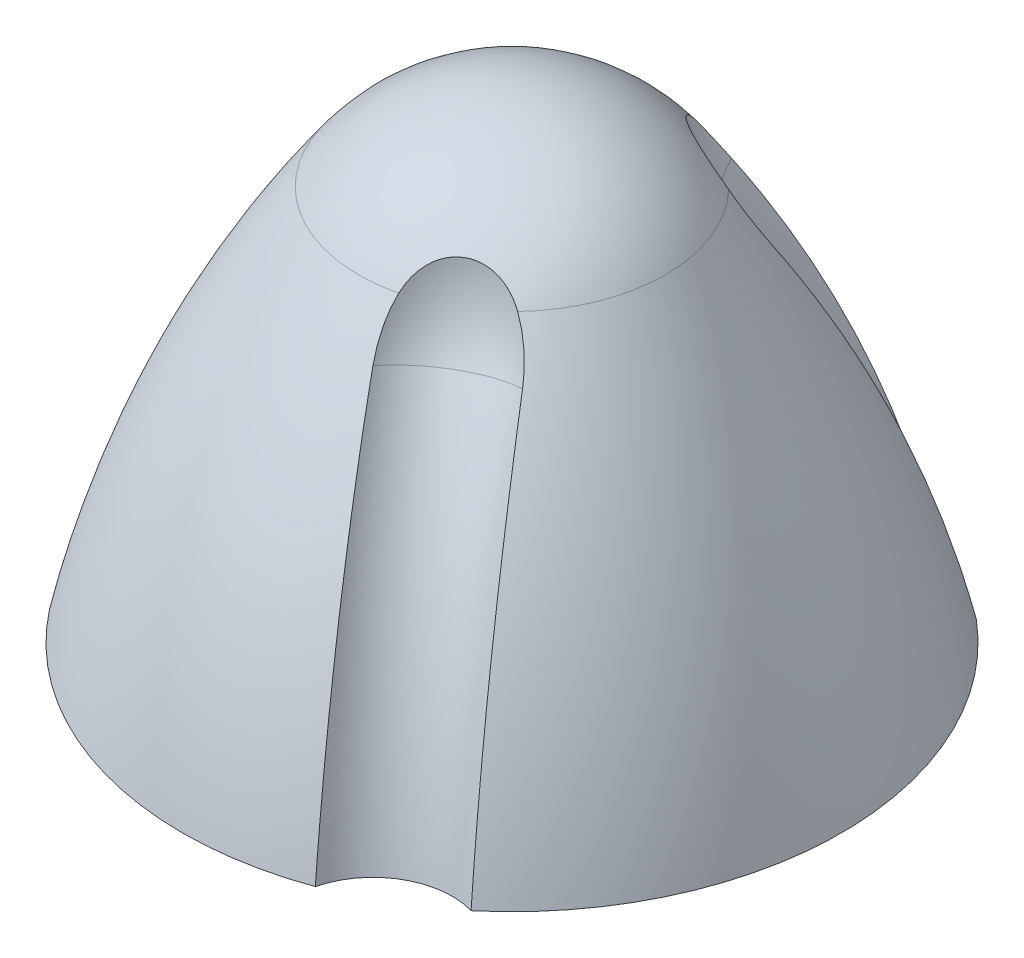
from build123d import *

# Parameters (mm, degrees)
CUT_EXTRUDE1_REACH             = 47.963
SKETCH2_W                      = 34.925
SKETCH2_H                      = 22.225
CUT_EXTRUDE1_DIRECTION_2_REACH = 47.963
CUT_EXTRUDE2_DEPTH             = 9.525
CIRPATTERN1_COUNT              = 3
SKETCH6_R                      = 6.35
CUT_EXTRUDE3_DEPTH             = 3.175


with BuildPart() as part:
    # Sketch1 → Revolve1 (revolve)
    with BuildSketch(Plane.XY):
        with BuildLine():
            Line((0, 41.275), (0, 0))
            Line((0, 0), (7.5, 0))
            ThreePointArc((7.5, 0), (12.485619708, 5.484310547), (14.299969698, 12.670561319))
            ThreePointArc((14.299969698, 12.670561319), (14.3, 12.7), (14.299969698, 12.729438681))
            ThreePointArc((14.299969698, 12.729438681), (12.201631467, 26.047427638), (6.1595, 38.1))
            ThreePointArc((6.1595, 38.1), (3.464825582, 40.434546629), (0, 41.275))
        make_face()
    revolve(axis=Axis((0, 0, 0), (0, 1, 0)))

    # Sketch2 → Cut-Extrude1 (cut, up to next)
    with BuildSketch(Plane(origin=(0, 0, 0), x_dir=(0, 0, -1), z_dir=(1, 0, 0)), mode=Mode.PRIVATE) as cut_extrude1_sk1:
        with Locations((0, 11.1125)):
            Rectangle(SKETCH2_W, SKETCH2_H)
    cut_extrude1_tool1 = extrude(cut_extrude1_sk1.sketch, amount=-CUT_EXTRUDE1_REACH, mode=Mode.PRIVATE) & part.part
    add(cut_extrude1_tool1.solids().sort_by_distance((0, 11.1125, 0))[0], mode=Mode.SUBTRACT)

    # Sketch2 → Cut-Extrude1 direction 2 (cut, up to next)
    with BuildSketch(Plane(origin=(0, 0, 0), x_dir=(0, 0, -1), z_dir=(1, 0, 0)), mode=Mode.PRIVATE) as cut_extrude1_direction_2_sk1:
        with Locations((0, 11.1125)):
            Rectangle(SKETCH2_W, SKETCH2_H)
    cut_extrude1_direction_2_tool1 = extrude(cut_extrude1_direction_2_sk1.sketch, amount=CUT_EXTRUDE1_DIRECTION_2_REACH, mode=Mode.PRIVATE) & part.part
    add(cut_extrude1_direction_2_tool1.solids().sort_by_distance((0, 11.1125, 0))[0], mode=Mode.SUBTRACT)

    # Sketch3 → Cut-Extrude2 (cut)
    with BuildSketch(Plane.XZ.offset(-22.225)):
        with BuildLine():
            Line((-2.434829201, -1.7526), (2.434829201, -1.7526))
            ThreePointArc((2.434829201, -1.7526), (0, 3), (-2.434829201, -1.7526))
        make_face()
    extrude(amount=-CUT_EXTRUDE2_DEPTH, mode=Mode.SUBTRACT)

    # Cut-Sweep1: sweep along a path in Sketch4
    with BuildLine(Plane.XY) as cut_sweep1_path:
        Line((-6.35, 41.275), (-6.35, 39.7002))
        ThreePointArc((-6.35, 39.7002), (-6.599150778, 37.96819754), (-7.326398315, 36.376651231))
        ThreePointArc((-7.326398315, 36.376651231), (-10.906399133, 29.561182531), (-13.240375425, 22.225))
    # Sketch5 → Cut-Sweep1 (sweep, cut)
    with BuildSketch(Plane.XZ.offset(-22.225)):
        with BuildLine():
            ThreePointArc((-13.04083059, 2.290039063), (-12.065, 0), (-13.04083059, -2.290039063))
            ThreePointArc((-13.04083059, -2.290039063), (-13.240375425, 0), (-13.04083059, 2.290039063))
        make_face()
    cut_sweep1 = sweep(path=cut_sweep1_path.line, mode=Mode.SUBTRACT)

    # CirPattern1: Cut-Sweep1 ×3 about axis
    cirpattern1_axis = Axis((0, 42.243264125, 0), (0, -1, 0))
    for i in range(1, CIRPATTERN1_COUNT):
        add(cut_sweep1.rotate(cirpattern1_axis, i * 360 / CIRPATTERN1_COUNT), mode=Mode.SUBTRACT)

    # Sketch6 → Cut-Extrude3 (cut)
    with BuildSketch(Plane.XZ.offset(-22.225)):
        with Locations(Location((0, 0, 0), (0, 0, 270))):
            Circle(SKETCH6_R)
    extrude(amount=-CUT_EXTRUDE3_DEPTH, mode=Mode.SUBTRACT)


solid = part.part
